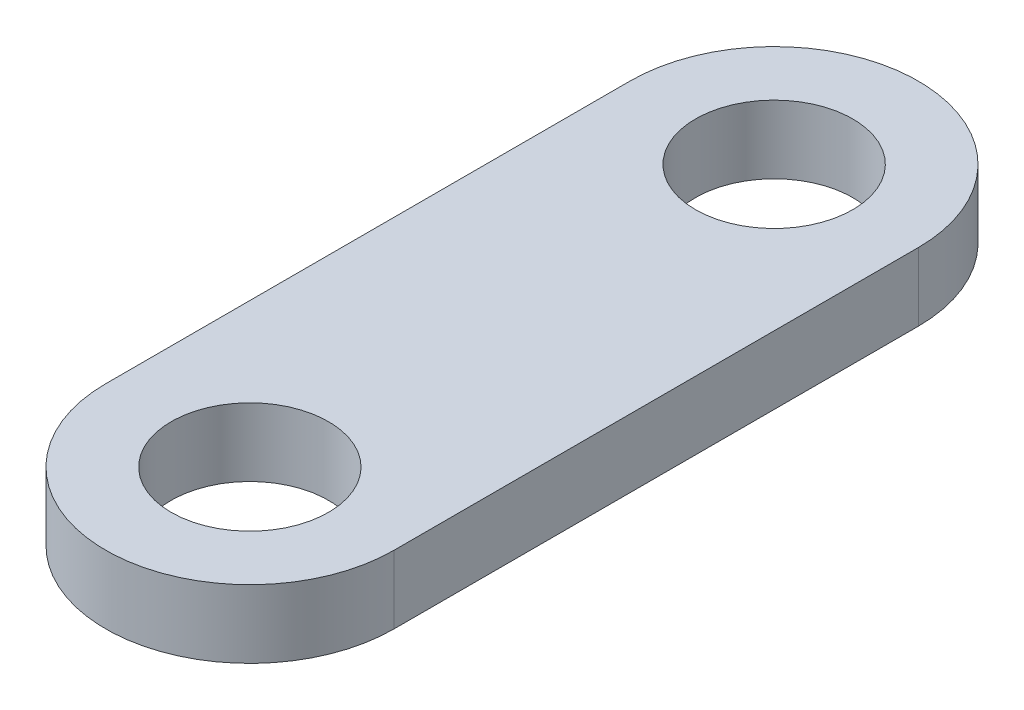
from build123d import *

# Parameters (mm, degrees)
SKETCH1_R           = 3
BOSS_EXTRUDE1_DEPTH = 2.6


with BuildPart() as part:
    # Sketch1 → Boss-Extrude1 (new body)
    with BuildSketch(Plane(origin=(0, 0, 0), x_dir=(1, 0, 0), z_dir=(0, 1, 0))):
        with BuildLine():
            Line((5.5, 12.397694824), (5.5, -7.602305176))
            ThreePointArc((5.5, -7.602305176), (0, -13.102305176), (-5.5, -7.602305176))
            Line((-5.5, -7.602305176), (-5.5, 12.397694824))
            ThreePointArc((-5.5, 12.397694824), (0, 17.897694824), (5.5, 12.397694824))
        make_face()
        with Locations(Location((0, 12.397694824, 0), (0, 0, 270))):
            Circle(SKETCH1_R, mode=Mode.SUBTRACT)
        with Locations(Location((0, -7.602305176, 0), (0, 0, 270))):
            Circle(SKETCH1_R, mode=Mode.SUBTRACT)
    extrude(amount=BOSS_EXTRUDE1_DEPTH)


solid = part.part
